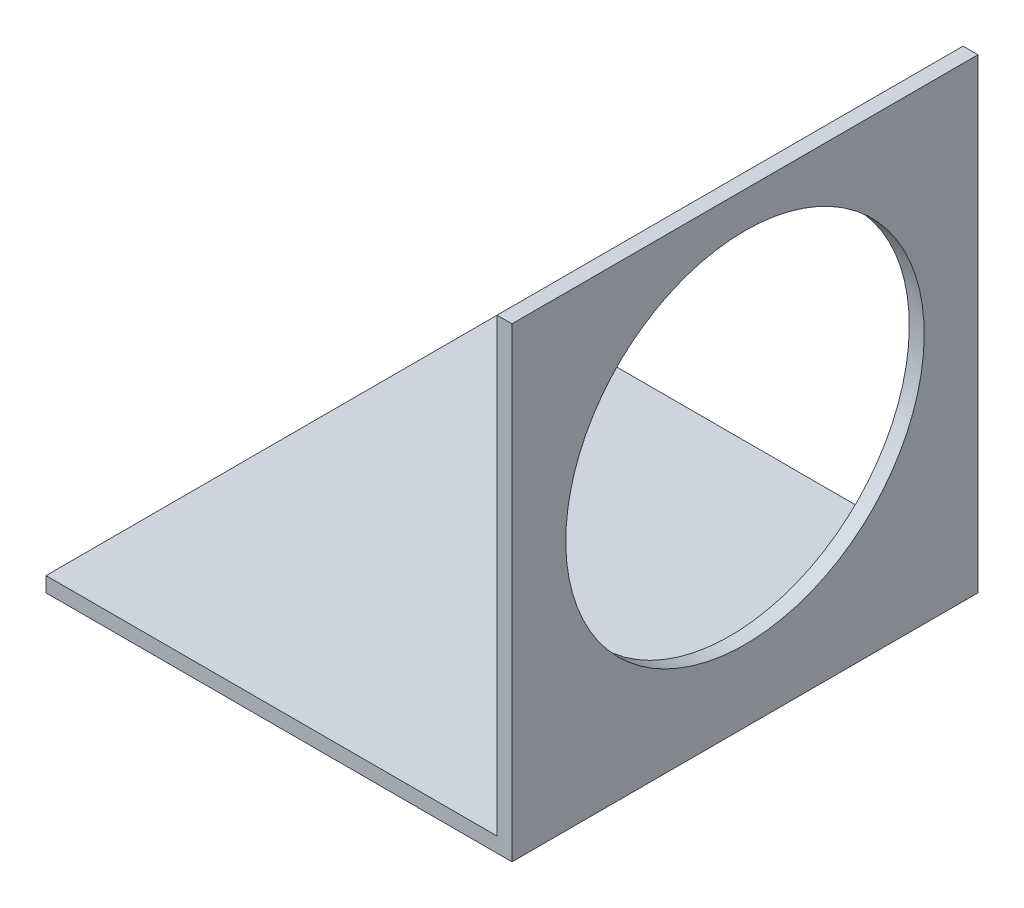
from build123d import *

# Parameters (mm, degrees)
BOSS_EXTRUDE1_DEPTH = 99.06
SKETCH2_R           = 38.1
CUT_EXTRUDE1_DEPTH  = 170.763660496


with BuildPart() as part:
    # Sketch1 → Boss-Extrude1 (new body)
    with BuildSketch(Plane.XY):
        Polygon((0, 0), (-95.885, 0), (-95.885, -3.175), (3.175, -3.175), (3.175, 95.885), (0, 95.885), align=None)
    extrude(amount=BOSS_EXTRUDE1_DEPTH)

    # Sketch2 → Cut-Extrude1 (cut, through all)
    with BuildSketch(Plane(origin=(3.175, 0, 0), x_dir=(0, 0, -1), z_dir=(1, 0, 0))):
        with Locations(Location((-49.53, 50.165, 0), (0, 0, 90))):
            Circle(SKETCH2_R)
    extrude(amount=-CUT_EXTRUDE1_DEPTH, mode=Mode.SUBTRACT)


solid = part.part
